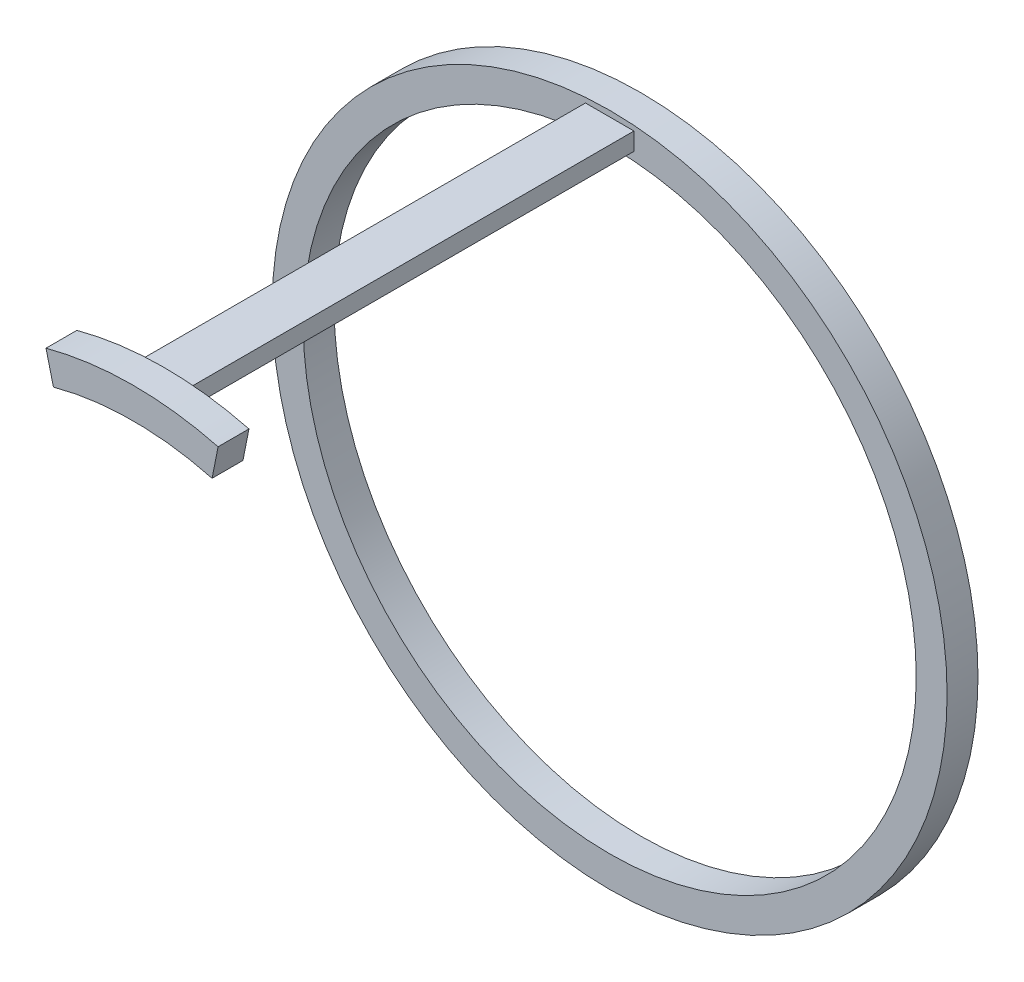
from build123d import *

# Parameters (mm, degrees)
SKETCH1_R           = 76.5
SKETCH1_R_2         = 69.5
BOSS_EXTRUDE1_DEPTH = 7
SKETCH2_W           = 10.998336412
SKETCH2_H           = 3.996279506
BOSS_EXTRUDE2_DEPTH = 101
BOSS_EXTRUDE3_DEPTH = 7


with BuildPart() as part:
    # Sketch1 → Boss-Extrude1 (new body)
    with BuildSketch(Plane.XY):
        Circle(SKETCH1_R)
        Circle(SKETCH1_R_2, mode=Mode.SUBTRACT)
    extrude(amount=BOSS_EXTRUDE1_DEPTH)

    # Sketch2 → Boss-Extrude2 (add)
    with BuildSketch(Plane.XY.offset(7)):
        with Locations((0, 73.186602974)):
            Rectangle(SKETCH2_W, SKETCH2_H)
    extrude(amount=BOSS_EXTRUDE2_DEPTH)

    # Sketch3 → Boss-Extrude3 (add)
    with BuildSketch(Plane.XY.offset(108)):
        with BuildLine():
            Line((-18.119939766, 67.096332112), (-19.801444594, 73.89284669))
            ThreePointArc((-19.801444594, 73.89284669), (-0.302678458, 76.499401212), (19.216103117, 74.047223993))
            Line((19.216103117, 74.047223993), (17.850832513, 67.168428436))
            ThreePointArc((17.850832513, 67.168428436), (-0.139298774, 69.499860402), (-18.119939766, 67.096332112))
        make_face()
    extrude(amount=BOSS_EXTRUDE3_DEPTH)


solid = part.part
